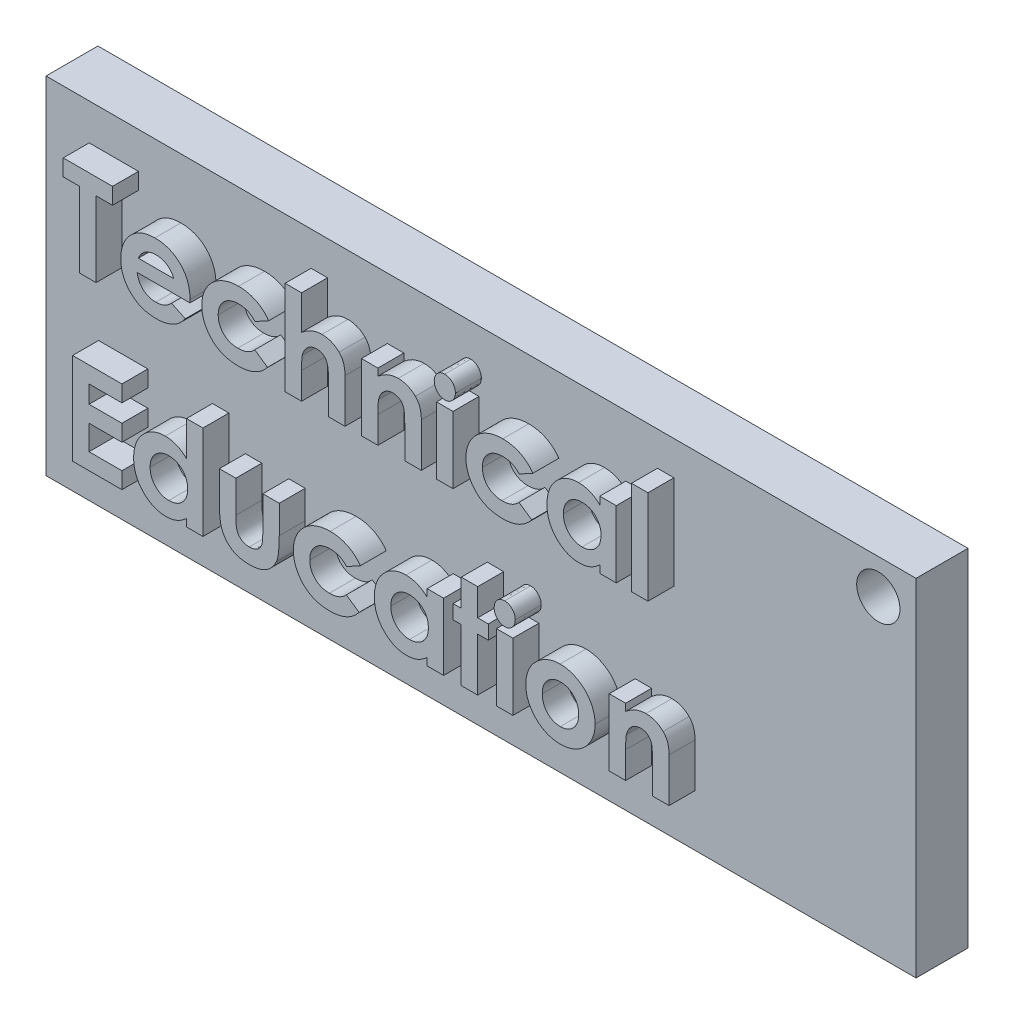
from build123d import *

# Parameters (mm, degrees)
BOSS_EXTRUDE1_DEPTH = 3
SKETCH3_W           = 0.949786325
SKETCH3_H           = 3.86698718
SKETCH3_W_2         = 0.949786324
SKETCH3_H_2         = 5.427350428
BOSS_EXTRUDE2_DEPTH = 1.5
SKETCH4_R           = 1.25
CUT_EXTRUDE1_DEPTH  = 41.5
SKETCH6_W           = 50.270674218
SKETCH6_H           = 20
BOSS_EXTRUDE3_DEPTH = 3
SKETCH7_R           = 1.25
CUT_EXTRUDE2_DEPTH  = 3


with BuildPart() as part:
    # Sketch1 → Boss-Extrude1 (new body)
    with BuildSketch(Plane.XY):
        with BuildLine():
            Line((-23, -10), (23, -10))
            ThreePointArc((23, -10), (24.414213562, -9.414213562), (25, -8))
            Line((25, -8), (25, 8))
            ThreePointArc((25, 8), (24.414213562, 9.414213562), (23, 10))
            Line((23, 10), (-23, 10))
            ThreePointArc((-23, 10), (-24.414213562, 9.414213562), (-25, 8))
            Line((-25, 8), (-25, -8))
            ThreePointArc((-25, -8), (-24.414213562, -9.414213562), (-23, -10))
        make_face()
    extrude(amount=BOSS_EXTRUDE1_DEPTH)

    # Sketch3 → Boss-Extrude2 (add)
    # profile 1 of 20: a face of its own
    with BuildSketch(Plane.XY.offset(3)):
        Polygon((-22.641889718, 7.899192591), (-19.792530744, 7.899192591), (-19.792530744, 6.949406266), (-20.742317068, 6.949406266), (-20.742317068, 2.607525924), (-21.692103393, 2.607525924), (-21.692103393, 6.949406266), (-22.641889718, 6.949406266), align=None)
    # profile 2 of 20: a face of its own
    with BuildSketch(Plane.XY.offset(3)):
        with BuildLine():
            Line((-15.318146729, 4.303572933), (-18.367851256, 4.303572933))
            add(Edge.make_bspline(
                [(-18.367851256, 4.303572933), (-18.361633155, 4.268137097), (-18.349414095, 4.198502882), (-18.322879973, 4.097353144), (-18.289018454, 4.002031337), (-18.248437555, 3.912410041), (-18.201821471, 3.828015463), (-18.14744767, 3.749243445), (-18.086005836, 3.676163566), (-18.017851208, 3.609093438), (-17.944119801, 3.548997149), (-17.865169184, 3.496349002), (-17.780917885, 3.453180741), (-17.692331814, 3.416794377), (-17.598749029, 3.38797269), (-17.5000318, 3.368094921), (-17.396441811, 3.35635305), (-17.325873145, 3.354654723), (-17.289801377, 3.353786608)],
                knots=[0, 0, 0, 0, 1.091296461, 2.144483647, 3.168565212, 4.157007626, 5.126487748, 6.090021542, 7.05641414, 8.019231907, 8.98705074, 9.938580405, 10.892824166, 11.854447369, 12.841318655, 13.858982407, 14.905600794, 16, 16, 16, 16], degree=3))
            add(Edge.make_bspline(
                [(-17.289801377, 3.353786608), (-17.246260303, 3.354936135), (-17.160515107, 3.357199891), (-17.034897756, 3.377276044), (-16.913407479, 3.407600192), (-16.797194002, 3.452694745), (-16.684911176, 3.508829536), (-16.578407518, 3.578766579), (-16.475839536, 3.660462084), (-16.41326098, 3.723432948), (-16.381356198, 3.755537743)],
                knots=[0, 0, 0, 0, 1.021034703, 2.010718019, 2.977989445, 3.954245119, 4.929443971, 5.918328161, 6.938689359, 8, 8, 8, 8], degree=3))
            Line((-16.381356198, 3.755537743), (-15.586334162, 3.377107255))
            add(Edge.make_bspline(
                [(-15.586334162, 3.377107255), (-15.611364967, 3.342518524), (-15.660962586, 3.273982226), (-15.741929035, 3.177533955), (-15.82642268, 3.087543805), (-15.914506536, 3.004603655), (-16.006292317, 2.928949853), (-16.101524695, 2.859660797), (-16.201595453, 2.798596872), (-16.304503694, 2.742803841), (-16.412376723, 2.694972735), (-16.524916007, 2.654184055), (-16.641644878, 2.617311436), (-16.764037371, 2.589216521), (-16.891074324, 2.566976815), (-17.023059634, 2.551183677), (-17.159975907, 2.541429013), (-17.2530371, 2.540272609), (-17.30040167, 2.539684044)],
                knots=[0, 0, 0, 0, 1.028154879, 2.037251081, 3.030720504, 4.000128189, 4.949298328, 5.894184978, 6.834267904, 7.770992897, 8.712077017, 9.673380525, 10.653304757, 11.658697181, 12.695551717, 13.758623199, 14.859225354, 16, 16, 16, 16], degree=3))
            add(Edge.make_bspline(
                [(-17.30040167, 2.539684044), (-17.373271284, 2.541169636), (-17.515982223, 2.544079083), (-17.724722769, 2.571082912), (-17.922968392, 2.615858172), (-18.111278868, 2.67672326), (-18.288840193, 2.757084245), (-18.455740243, 2.855372395), (-18.613646588, 2.969703331), (-18.757734308, 3.102476553), (-18.889002472, 3.246992313), (-19.004300266, 3.40219237), (-19.100779818, 3.566992401), (-19.180010766, 3.740301724), (-19.241591812, 3.922563943), (-19.285988173, 4.113858595), (-19.313203675, 4.314094313), (-19.316143084, 4.450477188), (-19.317637581, 4.519818927)],
                knots=[0, 0, 0, 0, 1.103565453, 2.161269334, 3.182010356, 4.179077853, 5.15417608, 6.128274628, 7.109042802, 8.101804412, 9.090965879, 10.063106201, 11.02526161, 11.978650795, 12.945248442, 13.93468508, 14.949922959, 16, 16, 16, 16], degree=3))
            add(Edge.make_bspline(
                [(-19.317637581, 4.519818927), (-19.316128375, 4.590922727), (-19.313159081, 4.730816262), (-19.286222499, 4.935675514), (-19.241469071, 5.131138949), (-19.179707887, 5.31747574), (-19.101678882, 5.49526867), (-19.003971794, 5.662962263), (-18.889059688, 5.821140336), (-18.758264415, 5.969062918), (-18.613566295, 6.102579209), (-18.459810871, 6.221568906), (-18.295270545, 6.32071902), (-18.121806408, 6.40083225), (-17.940528001, 6.465922228), (-17.749339997, 6.509234172), (-17.549697046, 6.53831555), (-17.413225522, 6.540993763), (-17.343862875, 6.542354984)],
                knots=[0, 0, 0, 0, 1.079208495, 2.12329425, 3.130605359, 4.119693003, 5.099659317, 6.073216462, 7.060498243, 8.06384408, 9.066070512, 10.045757761, 11.010926815, 11.975797609, 12.942977511, 13.929384301, 14.947594487, 16, 16, 16, 16], degree=3))
            add(Edge.make_bspline(
                [(-17.343862875, 6.542354984), (-17.270644166, 6.540846344), (-17.126886777, 6.537884285), (-16.916692417, 6.511099721), (-16.717130468, 6.466051427), (-16.527350683, 6.405712628), (-16.349776628, 6.32332164), (-16.180506463, 6.227452205), (-16.023600246, 6.11064992), (-15.877385524, 5.978526447), (-15.745396855, 5.831940032), (-15.630024134, 5.672702289), (-15.531856149, 5.502367286), (-15.452290022, 5.320244276), (-15.390772209, 5.126880012), (-15.34633475, 4.922525615), (-15.319326838, 4.706403818), (-15.316442124, 4.558412838), (-15.314966641, 4.482717898)],
                knots=[0, 0, 0, 0, 1.080001299, 2.120471247, 3.119684163, 4.095710327, 5.052285597, 6.002875087, 6.961153713, 7.931888285, 8.906493152, 9.865905668, 10.82813294, 11.801621613, 12.7925306, 13.817193356, 14.883530496, 16, 16, 16, 16], degree=3))
            Line((-15.314966641, 4.482717898), (-15.318146729, 4.303572933))
        make_face()
        with BuildLine():
            add(Edge.make_bspline(
                [(-16.264752966, 5.049833617), (-16.282676015, 5.098200665), (-16.318311705, 5.194366958), (-16.398811245, 5.327052976), (-16.50563156, 5.441964457), (-16.62987125, 5.543696502), (-16.771822875, 5.626268584), (-16.927013291, 5.686053454), (-17.09348092, 5.721901212), (-17.208001679, 5.726105524), (-17.26648073, 5.72825242)],
                knots=[0, 0, 0, 0, 0.954238005, 1.897273737, 2.851915805, 3.847685534, 4.862635127, 5.880135777, 6.917509367, 8, 8, 8, 8], degree=3))
            add(Edge.make_bspline(
                [(-17.26648073, 5.72825242), (-17.330349375, 5.726190065), (-17.455199278, 5.72215859), (-17.635286762, 5.679282372), (-17.80515878, 5.615290898), (-17.905305694, 5.54931433), (-17.955499827, 5.516246544)],
                knots=[0, 0, 0, 0, 1.044195649, 2.041185066, 3.018232172, 4, 4, 4, 4], degree=3))
            add(Edge.make_bspline(
                [(-17.955499827, 5.516246544), (-17.986817218, 5.491061394), (-18.053584293, 5.437367942), (-18.140294886, 5.330254603), (-18.225705542, 5.200564395), (-18.274266209, 5.102055519), (-18.300009376, 5.049833617)],
                knots=[0, 0, 0, 0, 0.82159062, 1.751589201, 2.808063854, 4, 4, 4, 4], degree=3))
            Line((-18.300009376, 5.049833617), (-16.264752966, 5.049833617))
        make_face(mode=Mode.SUBTRACT)
    # profile 3 of 20: a face of its own
    with BuildSketch(Plane.XY.offset(3)):
        with BuildLine():
            Line((-10.769560658, 5.685851245), (-11.556102458, 5.253359258))
            add(Edge.make_bspline(
                [(-11.556102458, 5.253359258), (-11.592154668, 5.289462369), (-11.661456078, 5.358861626), (-11.772586459, 5.446710075), (-11.881731087, 5.519446146), (-11.993389541, 5.573121631), (-12.108559917, 5.613544416), (-12.23139627, 5.640317314), (-12.363332316, 5.657946317), (-12.454592629, 5.659572197), (-12.501648666, 5.66041054)],
                knots=[0, 0, 0, 0, 1.150764855, 2.212059359, 3.192108068, 4.105322427, 5.000809612, 5.941206042, 6.938435785, 8, 8, 8, 8], degree=3))
            add(Edge.make_bspline(
                [(-12.501648666, 5.66041054), (-12.544802298, 5.65936822), (-12.629250339, 5.657328489), (-12.752642327, 5.64209309), (-12.869913767, 5.61816409), (-12.980854151, 5.583155878), (-13.085265882, 5.536908124), (-13.184012402, 5.482180865), (-13.276134152, 5.416836526), (-13.360328968, 5.341803962), (-13.436329588, 5.259194771), (-13.504126019, 5.171088519), (-13.559667306, 5.076178171), (-13.607686193, 4.976694463), (-13.642990265, 4.870768869), (-13.668819582, 4.759362553), (-13.683542053, 4.642470581), (-13.685675079, 4.562613394), (-13.686761513, 4.521938985)],
                knots=[0, 0, 0, 0, 1.121765476, 2.195200973, 3.227634963, 4.230038321, 5.213228299, 6.192116585, 7.160777141, 8.14345191, 9.118668839, 10.075979138, 11.027630062, 11.972829041, 12.943187208, 13.923755399, 14.94248691, 16, 16, 16, 16], degree=3))
            add(Edge.make_bspline(
                [(-13.686761513, 4.521938985), (-13.685613602, 4.482326045), (-13.683372224, 4.404978973), (-13.669601953, 4.291337692), (-13.645696245, 4.183156042), (-13.609852766, 4.081005947), (-13.566890348, 3.983945729), (-13.512937416, 3.892747327), (-13.449491741, 3.8070125), (-13.376219307, 3.727486409), (-13.295052043, 3.655962448), (-13.207547369, 3.592799385), (-13.113966361, 3.539248793), (-13.013218896, 3.497223613), (-12.906947558, 3.462981884), (-12.794442665, 3.438600432), (-12.675823938, 3.42506704), (-12.594964556, 3.42279239), (-12.553590105, 3.421628489)],
                knots=[0, 0, 0, 0, 1.070556293, 2.090336998, 3.088792742, 4.058148387, 5.011235098, 5.952916408, 6.915475435, 7.888633318, 8.869583867, 9.83422472, 10.800707077, 11.776204622, 12.778807041, 13.814557445, 14.881744048, 16, 16, 16, 16], degree=3))
            add(Edge.make_bspline(
                [(-12.553590105, 3.421628489), (-12.50264824, 3.422794187), (-12.403217121, 3.425069462), (-12.25867313, 3.444367611), (-12.122659212, 3.476279964), (-11.995160943, 3.520449194), (-11.876356697, 3.578201286), (-11.766551731, 3.648741158), (-11.664617253, 3.731548447), (-11.605174682, 3.796106875), (-11.575182987, 3.828679771)],
                knots=[0, 0, 0, 0, 1.116373375, 2.178998604, 3.189797796, 4.174590301, 5.13072713, 6.078291395, 7.030403691, 8, 8, 8, 8], degree=3))
            Line((-11.575182987, 3.828679771), (-10.837402538, 3.321985727))
            add(Edge.make_bspline(
                [(-10.837402538, 3.321985727), (-10.888541936, 3.259461347), (-10.989461647, 3.136074238), (-11.165538558, 2.977032759), (-11.355050497, 2.84038079), (-11.561808959, 2.731306919), (-11.782802856, 2.644552599), (-12.019759044, 2.583225908), (-12.272276728, 2.547125498), (-12.445701431, 2.542204177), (-12.534509576, 2.539684044)],
                knots=[0, 0, 0, 0, 0.997876357, 1.969233105, 2.924898516, 3.881013542, 4.852507933, 5.855329832, 6.901747111, 8, 8, 8, 8], degree=3))
            add(Edge.make_bspline(
                [(-12.534509576, 2.539684044), (-12.614442415, 2.541531854), (-12.770560063, 2.545140831), (-12.998097656, 2.572778784), (-13.212108577, 2.619331154), (-13.41303308, 2.683982827), (-13.60068798, 2.767730953), (-13.774464696, 2.871609922), (-13.935535347, 2.992730198), (-14.080993574, 3.131663949), (-14.210775687, 3.282894838), (-14.32407594, 3.442165008), (-14.422063182, 3.606620803), (-14.498934077, 3.778999526), (-14.561758785, 3.956614361), (-14.60418862, 4.141588442), (-14.63217371, 4.332398112), (-14.63507806, 4.461769385), (-14.636547838, 4.527239132)],
                knots=[0, 0, 0, 0, 1.183377041, 2.311265848, 3.387807024, 4.421911742, 5.431260577, 6.423665966, 7.413571885, 8.409103097, 9.395976332, 10.359992013, 11.300391101, 12.225292883, 13.150239058, 14.085544813, 15.031169026, 16, 16, 16, 16], degree=3))
            add(Edge.make_bspline(
                [(-14.636547838, 4.527239132), (-14.635760467, 4.57285246), (-14.634200928, 4.663198438), (-14.620887394, 4.797372291), (-14.600176011, 4.929269266), (-14.569049246, 5.057963518), (-14.530768819, 5.184079422), (-14.484233778, 5.307591629), (-14.427608608, 5.427862795), (-14.364443058, 5.545916017), (-14.292451923, 5.658634865), (-14.213911088, 5.765969591), (-14.12893121, 5.867262818), (-14.036513991, 5.961570522), (-13.937303821, 6.049567512), (-13.832742961, 6.133039084), (-13.71944787, 6.207680417), (-13.601357124, 6.277857056), (-13.477453492, 6.340327782), (-13.349161079, 6.394248254), (-13.217471298, 6.440061472), (-13.082068494, 6.476896223), (-12.943533844, 6.507254811), (-12.800634635, 6.526521619), (-12.654553117, 6.540063845), (-12.555742323, 6.541586667), (-12.505888783, 6.542354984)],
                knots=[0, 0, 0, 0, 1.00272354, 1.986087015, 2.96193297, 3.936200312, 4.894695956, 5.858592327, 6.835334787, 7.815655071, 8.800643866, 9.773423113, 10.738352213, 11.705312252, 12.673769326, 13.65298065, 14.64420052, 15.654211674, 16.672258995, 17.692438602, 18.712115155, 19.735602823, 20.776372304, 21.827874031, 22.90408564, 24, 24, 24, 24], degree=3))
            add(Edge.make_bspline(
                [(-12.505888783, 6.542354984), (-12.459581241, 6.541831438), (-12.368252975, 6.540798894), (-12.233381772, 6.530002215), (-12.102189581, 6.511663579), (-11.974453137, 6.487402337), (-11.849784508, 6.457338433), (-11.729854582, 6.417264257), (-11.613023717, 6.371781575), (-11.462544328, 6.303107475), (-11.28515667, 6.200600265), (-11.090432547, 6.05358233), (-10.916812418, 5.881592787), (-10.818905465, 5.751445222), (-10.769560658, 5.685851245)],
                knots=[0, 0, 0, 0, 0.826738014, 1.630502179, 2.413926014, 3.191023582, 3.95155221, 4.701751672, 5.446919844, 6.189438973, 7.653650558, 9.094719814, 10.535747635, 12, 12, 12, 12], degree=3))
        make_face()
    # profile 4 of 20: a face of its own
    with BuildSketch(Plane.XY.offset(3)):
        with BuildLine():
            Line((-9.819774333, 8.034876352), (-8.869988008, 8.034876352))
            Line((-8.869988008, 8.034876352), (-8.869988008, 6.055801499))
            add(Edge.make_bspline(
                [(-8.869988008, 6.055801499), (-8.822145258, 6.094710049), (-8.728891448, 6.170549556), (-8.582573162, 6.269350439), (-8.436557517, 6.353661579), (-8.289295073, 6.421989993), (-8.141424707, 6.47553497), (-7.992691071, 6.513508174), (-7.842950982, 6.538421948), (-7.742567464, 6.541042574), (-7.692295367, 6.542354984)],
                knots=[0, 0, 0, 0, 1.13710654, 2.216417683, 3.252896077, 4.244436563, 5.207303112, 6.149540546, 7.073289332, 8, 8, 8, 8], degree=3))
            add(Edge.make_bspline(
                [(-7.692295367, 6.542354984), (-7.644188344, 6.541078504), (-7.549750219, 6.538572666), (-7.411203764, 6.520472645), (-7.278503928, 6.489327174), (-7.151323811, 6.446512325), (-7.030538389, 6.388932661), (-6.91457698, 6.321485354), (-6.804817942, 6.240677172), (-6.738035819, 6.178386284), (-6.704347984, 6.146964025)],
                knots=[0, 0, 0, 0, 1.056403236, 2.073808271, 3.062028718, 4.046096703, 5.014652014, 5.995532726, 6.988858718, 8, 8, 8, 8], degree=3))
            add(Edge.make_bspline(
                [(-6.704347984, 6.146964025), (-6.67668138, 6.117602803), (-6.620946755, 6.058454355), (-6.551530767, 5.956483798), (-6.491590756, 5.845412558), (-6.442748191, 5.724196906), (-6.406423225, 5.592780418), (-6.378300335, 5.452245722), (-6.362747779, 5.30105834), (-6.360828379, 5.196858118), (-6.359838436, 5.143116202)],
                knots=[0, 0, 0, 0, 0.887296576, 1.787466942, 2.706642908, 3.663267187, 4.658426068, 5.705361056, 6.816525637, 8, 8, 8, 8], degree=3))
            Line((-6.359838436, 5.143116202), (-6.359838436, 2.607525924))
            Line((-6.359838436, 2.607525924), (-7.309624761, 2.607525924))
            Line((-7.309624761, 2.607525924), (-7.309624761, 4.288732522))
            add(Edge.make_bspline(
                [(-7.309624761, 4.288732522), (-7.309809306, 4.342088944), (-7.310162545, 4.44421864), (-7.31333464, 4.590879564), (-7.31851477, 4.724115408), (-7.325598834, 4.843966434), (-7.335489735, 4.949931765), (-7.345218132, 5.042770922), (-7.358869352, 5.122038891), (-7.379310324, 5.208171073), (-7.412576197, 5.300296393), (-7.460916927, 5.398498023), (-7.525486858, 5.479544551), (-7.600210586, 5.546387618), (-7.686608683, 5.597404775), (-7.78158818, 5.635085161), (-7.886772805, 5.656275678), (-7.959682053, 5.658996253), (-7.997583828, 5.66041054)],
                knots=[0, 0, 0, 0, 1.461461505, 2.797388094, 4.017818807, 5.113567707, 6.085313608, 6.932873269, 7.669572396, 8.286941306, 9.355291607, 10.346554054, 11.270113241, 12.175128673, 13.078071705, 14.003657132, 14.962203834, 16, 16, 16, 16], degree=3))
            add(Edge.make_bspline(
                [(-7.997583828, 5.66041054), (-8.046958613, 5.658480317), (-8.143664694, 5.654699758), (-8.282345493, 5.615783422), (-8.410260285, 5.554271213), (-8.525916186, 5.469018059), (-8.626698031, 5.362235089), (-8.711137663, 5.237074783), (-8.78020466, 5.094789017), (-8.810056659, 4.991031777), (-8.825466775, 4.937470502)],
                knots=[0, 0, 0, 0, 0.993549393, 1.945978497, 2.879753144, 3.843180486, 4.826017097, 5.826060929, 6.877775219, 8, 8, 8, 8], degree=3))
            add(Edge.make_bspline(
                [(-8.825466775, 4.937470502), (-8.829303926, 4.920915492), (-8.838053888, 4.88316465), (-8.844754774, 4.81875523), (-8.854698783, 4.740895279), (-8.8581482, 4.649118217), (-8.864609776, 4.543565601), (-8.866933612, 4.424066654), (-8.869273125, 4.29050903), (-8.869742054, 4.196865145), (-8.869988008, 4.147748614)],
                knots=[0, 0, 0, 0, 0.514379255, 1.17295301, 1.959069106, 2.891908278, 3.953016936, 5.163065833, 6.51201855, 8, 8, 8, 8], degree=3))
            Line((-8.869988008, 4.147748614), (-8.869988008, 2.607525924))
            Line((-8.869988008, 2.607525924), (-9.819774333, 2.607525924))
            Line((-9.819774333, 2.607525924), (-9.819774333, 8.034876352))
        make_face()
    # profile 5 of 20: a face of its own
    with BuildSketch(Plane.XY.offset(3)):
        with BuildLine():
            Line((-5.410052111, 6.474513104), (-4.460265786, 6.474513104))
            Line((-4.460265786, 6.474513104), (-4.460265786, 6.065341763))
            add(Edge.make_bspline(
                [(-4.460265786, 6.065341763), (-4.406080947, 6.107487847), (-4.302523187, 6.188037206), (-4.14509751, 6.290738049), (-3.996507163, 6.374794565), (-3.853439906, 6.438732253), (-3.713203926, 6.48473267), (-3.573528, 6.517781225), (-3.432332071, 6.538943124), (-3.337414133, 6.541218308), (-3.28999335, 6.542354984)],
                knots=[0, 0, 0, 0, 1.276643801, 2.439914479, 3.493451431, 4.44993799, 5.350072675, 6.235028322, 7.118224225, 8, 8, 8, 8], degree=3))
            add(Edge.make_bspline(
                [(-3.28999335, 6.542354984), (-3.241891348, 6.541055998), (-3.147463077, 6.53850598), (-3.008422652, 6.520670666), (-2.875583028, 6.48818691), (-2.747450534, 6.445057267), (-2.62532934, 6.388128613), (-2.507723386, 6.320535072), (-2.397158806, 6.238201566), (-2.329068243, 6.175500321), (-2.294625762, 6.143783937)],
                knots=[0, 0, 0, 0, 1.048836932, 2.058954983, 3.049370783, 4.026390553, 5.001981509, 5.982488534, 6.97947532, 8, 8, 8, 8], degree=3))
            add(Edge.make_bspline(
                [(-2.294625762, 6.143783937), (-2.267001625, 6.114392124), (-2.211551174, 6.055393384), (-2.141773749, 5.95443143), (-2.081896869, 5.844364419), (-2.032836086, 5.723922695), (-1.996582144, 5.592444507), (-1.968691492, 5.451517923), (-1.95304156, 5.30035386), (-1.951109502, 5.196505576), (-1.950116214, 5.143116202)],
                knots=[0, 0, 0, 0, 0.889584746, 1.785680191, 2.700364693, 3.65222533, 4.649950538, 5.707241244, 6.821271309, 8, 8, 8, 8], degree=3))
            Line((-1.950116214, 5.143116202), (-1.950116214, 2.607525924))
            Line((-1.950116214, 2.607525924), (-2.899902538, 2.607525924))
            Line((-2.899902538, 2.607525924), (-2.899902538, 4.286612463))
            add(Edge.make_bspline(
                [(-2.899902538, 4.286612463), (-2.900103397, 4.341381341), (-2.900488306, 4.44633573), (-2.903443553, 4.596541233), (-2.909213916, 4.732196309), (-2.914473453, 4.853547945), (-2.924800013, 4.960165263), (-2.934112672, 5.052723231), (-2.948402044, 5.130382157), (-2.966994836, 5.213915984), (-2.999462429, 5.303354221), (-3.049866784, 5.397592179), (-3.113811778, 5.477649426), (-3.188685639, 5.544087202), (-3.274405678, 5.596645576), (-3.369936092, 5.633623667), (-3.474764723, 5.656669321), (-3.547808081, 5.659131738), (-3.585741547, 5.66041054)],
                knots=[0, 0, 0, 0, 1.49886392, 2.872294502, 4.110984203, 5.214877267, 6.195405875, 7.042225351, 7.75923308, 8.355011229, 9.382752534, 10.352059385, 11.267231453, 12.171456522, 13.078624015, 14.003401117, 14.963110155, 16, 16, 16, 16], degree=3))
            add(Edge.make_bspline(
                [(-3.585741547, 5.66041054), (-3.635075616, 5.657908796), (-3.731582645, 5.653014899), (-3.871160755, 5.616110449), (-3.999360924, 5.553346843), (-4.11513565, 5.466494632), (-4.217382277, 5.359264816), (-4.301595311, 5.23138096), (-4.370667299, 5.085929532), (-4.400369281, 4.979726364), (-4.415744552, 4.92475015)],
                knots=[0, 0, 0, 0, 0.984188326, 1.925263693, 2.85911992, 3.81709677, 4.80007086, 5.801799564, 6.862098548, 8, 8, 8, 8], degree=3))
            add(Edge.make_bspline(
                [(-4.415744552, 4.92475015), (-4.419565918, 4.907484501), (-4.428088332, 4.868978634), (-4.435096939, 4.803927179), (-4.444846421, 4.726749927), (-4.448499312, 4.636050185), (-4.454851288, 4.532257199), (-4.457200552, 4.415233652), (-4.459554019, 4.285209008), (-4.460020671, 4.194391735), (-4.460265786, 4.146688585)],
                knots=[0, 0, 0, 0, 0.543362196, 1.211806945, 2.009705693, 2.934833164, 4.000995085, 5.207458376, 6.533175157, 8, 8, 8, 8], degree=3))
            Line((-4.460265786, 4.146688585), (-4.460265786, 2.607525924))
            Line((-4.460265786, 2.607525924), (-5.410052111, 2.607525924))
            Line((-5.410052111, 2.607525924), (-5.410052111, 6.474513104))
        make_face()
    # profile 6 of 20: a face of its own
    with BuildSketch(Plane.XY.offset(3)):
        with BuildLine():
            add(Edge.make_bspline(
                [(-0.595398666, 8.102718232), (-0.554462882, 8.100709768), (-0.474081526, 8.096765954), (-0.358924296, 8.058322545), (-0.253233296, 7.997986763), (-0.159799522, 7.915204633), (-0.082090046, 7.816347628), (-0.02271712, 7.705670638), (0.010357064, 7.583044097), (0.014950579, 7.498334966), (0.017298316, 7.455040281)],
                knots=[0, 0, 0, 0, 0.989868614, 1.943702388, 2.910836514, 3.924849579, 4.949916355, 5.946401046, 6.950409252, 8, 8, 8, 8], degree=3))
            add(Edge.make_bspline(
                [(0.017298316, 7.455040281), (0.015034577, 7.412064653), (0.010623574, 7.328324597), (-0.023478342, 7.207362769), (-0.080468245, 7.096739535), (-0.15880712, 6.99935074), (-0.25122795, 6.917901865), (-0.35460952, 6.856470723), (-0.46866321, 6.820165912), (-0.54779729, 6.815892418), (-0.58797846, 6.813722506)],
                knots=[0, 0, 0, 0, 1.05296456, 2.051751585, 3.055639087, 4.085634717, 5.099016424, 6.062201612, 7.016062274, 8, 8, 8, 8], degree=3))
            add(Edge.make_bspline(
                [(-0.58797846, 6.813722506), (-0.629271579, 6.81572379), (-0.71035225, 6.819653392), (-0.826454006, 6.858186749), (-0.933554653, 6.918047348), (-1.026583112, 7.002520846), (-1.105182536, 7.102080305), (-1.161962029, 7.215333951), (-1.197479007, 7.338799008), (-1.201694841, 7.424762739), (-1.20385553, 7.468820663)],
                knots=[0, 0, 0, 0, 0.989065327, 1.942068821, 2.907541208, 3.917690034, 4.939857478, 5.938239964, 6.943311734, 8, 8, 8, 8], degree=3))
            add(Edge.make_bspline(
                [(-1.20385553, 7.468820663), (-1.201504109, 7.511066538), (-1.196885084, 7.594052462), (-1.163612782, 7.713952655), (-1.105601275, 7.822768992), (-1.028451547, 7.919816327), (-0.935838436, 8.001054259), (-0.830210885, 8.059557604), (-0.715828667, 8.096413191), (-0.635956498, 8.100594851), (-0.595398666, 8.102718232)],
                knots=[0, 0, 0, 0, 1.038616768, 2.040212704, 3.031499824, 4.052181184, 5.074969369, 6.039807101, 7.004644834, 8, 8, 8, 8], degree=3))
        make_face()
    # profile 7 of 20: a face of its own
    with BuildSketch(Plane.XY.offset(3)):
        with Locations((-0.593278607, 4.541019514)):
            Rectangle(SKETCH3_W, SKETCH3_H)
    # profile 8 of 20: a face of its own
    with BuildSketch(Plane.XY.offset(3)):
        with BuildLine():
            Line((4.494862419, 5.685851245), (3.708320619, 5.253359258))
            add(Edge.make_bspline(
                [(3.708320619, 5.253359258), (3.672268409, 5.289462369), (3.602966999, 5.358861626), (3.491836618, 5.446710075), (3.38269199, 5.519446146), (3.271033536, 5.573121631), (3.15586316, 5.613544416), (3.033026807, 5.640317314), (2.901090761, 5.657946317), (2.809830448, 5.659572197), (2.762774411, 5.66041054)],
                knots=[0, 0, 0, 0, 1.150764855, 2.212059359, 3.192108068, 4.105322427, 5.000809612, 5.941206042, 6.938435785, 8, 8, 8, 8], degree=3))
            add(Edge.make_bspline(
                [(2.762774411, 5.66041054), (2.719620779, 5.65936822), (2.635172738, 5.657328489), (2.51178075, 5.64209309), (2.39450931, 5.61816409), (2.283568926, 5.583155878), (2.179157195, 5.536908124), (2.080410675, 5.482180865), (1.988288924, 5.416836526), (1.904094108, 5.341803962), (1.828093489, 5.259194771), (1.760297058, 5.171088519), (1.704755771, 5.076178171), (1.656736884, 4.976694463), (1.621432812, 4.870768869), (1.595603495, 4.759362553), (1.580881024, 4.642470581), (1.578747998, 4.562613394), (1.577661564, 4.521938985)],
                knots=[0, 0, 0, 0, 1.121765476, 2.195200973, 3.227634963, 4.230038321, 5.213228299, 6.192116585, 7.160777141, 8.14345191, 9.118668839, 10.075979138, 11.027630062, 11.972829041, 12.943187208, 13.923755399, 14.94248691, 16, 16, 16, 16], degree=3))
            add(Edge.make_bspline(
                [(1.577661564, 4.521938985), (1.578809475, 4.482326045), (1.581050853, 4.404978973), (1.594821124, 4.291337692), (1.618726832, 4.183156042), (1.654570311, 4.081005947), (1.697532729, 3.983945729), (1.751485661, 3.892747327), (1.814931336, 3.8070125), (1.88820377, 3.727486409), (1.969371034, 3.655962448), (2.056875708, 3.592799385), (2.150456716, 3.539248793), (2.251204181, 3.497223613), (2.357475519, 3.462981884), (2.469980412, 3.438600432), (2.588599138, 3.42506704), (2.669458521, 3.42279239), (2.710832972, 3.421628489)],
                knots=[0, 0, 0, 0, 1.070556293, 2.090336998, 3.088792742, 4.058148387, 5.011235098, 5.952916408, 6.915475435, 7.888633318, 8.869583867, 9.83422472, 10.800707077, 11.776204622, 12.778807041, 13.814557445, 14.881744048, 16, 16, 16, 16], degree=3))
            add(Edge.make_bspline(
                [(2.710832972, 3.421628489), (2.761774837, 3.422794187), (2.861205956, 3.425069462), (3.005749947, 3.444367611), (3.141763865, 3.476279964), (3.269262134, 3.520449194), (3.38806638, 3.578201286), (3.497871346, 3.648741158), (3.599805824, 3.731548447), (3.659248395, 3.796106875), (3.68924009, 3.828679771)],
                knots=[0, 0, 0, 0, 1.116373375, 2.178998604, 3.189797796, 4.174590301, 5.13072713, 6.078291395, 7.030403691, 8, 8, 8, 8], degree=3))
            Line((3.68924009, 3.828679771), (4.427020539, 3.321985727))
            add(Edge.make_bspline(
                [(4.427020539, 3.321985727), (4.375881141, 3.259461347), (4.27496143, 3.136074238), (4.098884519, 2.977032759), (3.90937258, 2.84038079), (3.702614118, 2.731306919), (3.481620221, 2.644552599), (3.244664033, 2.583225908), (2.992146349, 2.547125498), (2.818721646, 2.542204177), (2.729913501, 2.539684044)],
                knots=[0, 0, 0, 0, 0.997876357, 1.969233105, 2.924898516, 3.881013542, 4.852507933, 5.855329832, 6.901747111, 8, 8, 8, 8], degree=3))
            add(Edge.make_bspline(
                [(2.729913501, 2.539684044), (2.649980662, 2.541531854), (2.493863014, 2.545140831), (2.266325421, 2.572778784), (2.0523145, 2.619331154), (1.851389997, 2.683982827), (1.663735096, 2.767730953), (1.489958381, 2.871609922), (1.32888773, 2.992730198), (1.183429503, 3.131663949), (1.053647389, 3.282894838), (0.940347137, 3.442165008), (0.842359895, 3.606620803), (0.765489, 3.778999526), (0.702664292, 3.956614361), (0.660234457, 4.141588442), (0.632249367, 4.332398112), (0.629345017, 4.461769385), (0.627875239, 4.527239132)],
                knots=[0, 0, 0, 0, 1.183377041, 2.311265848, 3.387807024, 4.421911742, 5.431260577, 6.423665966, 7.413571885, 8.409103097, 9.395976332, 10.359992013, 11.300391101, 12.225292883, 13.150239058, 14.085544813, 15.031169026, 16, 16, 16, 16], degree=3))
            add(Edge.make_bspline(
                [(0.627875239, 4.527239132), (0.62866261, 4.57285246), (0.630222149, 4.663198438), (0.643535682, 4.797372291), (0.664247066, 4.929269266), (0.695373831, 5.057963518), (0.733654258, 5.184079422), (0.780189299, 5.307591629), (0.836814469, 5.427862795), (0.899980019, 5.545916017), (0.971971154, 5.658634865), (1.050511989, 5.765969591), (1.135491867, 5.867262818), (1.227909086, 5.961570522), (1.327119256, 6.049567512), (1.431680116, 6.133039084), (1.544975207, 6.207680417), (1.663065953, 6.277857056), (1.786969585, 6.340327782), (1.915261998, 6.394248254), (2.046951779, 6.440061472), (2.182354583, 6.476896223), (2.320889232, 6.507254811), (2.463788442, 6.526521619), (2.60986996, 6.540063845), (2.708680754, 6.541586667), (2.758534294, 6.542354984)],
                knots=[0, 0, 0, 0, 1.00272354, 1.986087015, 2.96193297, 3.936200312, 4.894695956, 5.858592327, 6.835334787, 7.815655071, 8.800643866, 9.773423113, 10.738352213, 11.705312252, 12.673769326, 13.65298065, 14.64420052, 15.654211674, 16.672258995, 17.692438602, 18.712115155, 19.735602823, 20.776372304, 21.827874031, 22.90408564, 24, 24, 24, 24], degree=3))
            add(Edge.make_bspline(
                [(2.758534294, 6.542354984), (2.804841836, 6.541831438), (2.896170102, 6.540798894), (3.031041305, 6.530002215), (3.162233496, 6.511663579), (3.28996994, 6.487402337), (3.414638569, 6.457338433), (3.534568495, 6.417264257), (3.65139936, 6.371781575), (3.801878749, 6.303107475), (3.979266407, 6.200600265), (4.17399053, 6.05358233), (4.347610659, 5.881592787), (4.445517612, 5.751445222), (4.494862419, 5.685851245)],
                knots=[0, 0, 0, 0, 0.826738014, 1.630502179, 2.413926014, 3.191023582, 3.95155221, 4.701751672, 5.446919844, 6.189438973, 7.653650558, 9.094719814, 10.535747635, 12, 12, 12, 12], degree=3))
        make_face()
    # profile 9 of 20: a face of its own
    with BuildSketch(Plane.XY.offset(3)):
        with BuildLine():
            Line((8.361849598, 6.474513104), (9.311635923, 6.474513104))
            Line((9.311635923, 6.474513104), (9.311635923, 2.607525924))
            Line((9.311635923, 2.607525924), (8.361849598, 2.607525924))
            Line((8.361849598, 2.607525924), (8.361849598, 3.029417618))
            add(Edge.make_bspline(
                [(8.361849598, 3.029417618), (8.314788036, 2.988351131), (8.223450837, 2.908649189), (8.079532966, 2.805233894), (7.935194551, 2.719929641), (7.789742041, 2.651989455), (7.640939892, 2.601822621), (7.487716789, 2.565500661), (7.327866155, 2.544080713), (7.219201897, 2.541164866), (7.164016399, 2.539684044)],
                knots=[0, 0, 0, 0, 1.129196829, 2.191548051, 3.199897424, 4.157751732, 5.089409408, 6.034969131, 7.002052659, 8, 8, 8, 8], degree=3))
            add(Edge.make_bspline(
                [(7.164016399, 2.539684044), (7.102068223, 2.541077684), (6.979655119, 2.543831596), (6.800027477, 2.572820963), (6.626579131, 2.617195651), (6.459450873, 2.67999138), (6.298946777, 2.761362334), (6.1438385, 2.859185432), (5.99678507, 2.976894849), (5.856562318, 3.109397598), (5.728175208, 3.255151565), (5.615937984, 3.412133704), (5.521330346, 3.578117571), (5.443823371, 3.752552852), (5.382854125, 3.935311523), (5.339391778, 4.126973237), (5.313748943, 4.327606448), (5.310575082, 4.464269933), (5.308964983, 4.533599309)],
                knots=[0, 0, 0, 0, 0.980476535, 1.937477201, 2.874147792, 3.812856188, 4.758993464, 5.720109578, 6.712210464, 7.737600662, 8.772720504, 9.783789959, 10.789002326, 11.793715968, 12.802552247, 13.835794126, 14.902098527, 16, 16, 16, 16], degree=3))
            add(Edge.make_bspline(
                [(5.308964983, 4.533599309), (5.310654788, 4.605389968), (5.313969529, 4.746215346), (5.338216661, 4.952869893), (5.380876965, 5.149283843), (5.439047355, 5.33572926), (5.513873462, 5.512238354), (5.605006661, 5.679100303), (5.713686733, 5.835878957), (5.838921249, 5.979905832), (5.974143768, 6.11191342), (6.118807958, 6.226836494), (6.270651588, 6.324468993), (6.429836017, 6.404175), (6.596338514, 6.465767768), (6.76950173, 6.510797111), (6.950094386, 6.537816299), (7.073115568, 6.540829525), (7.135395605, 6.542354984)],
                knots=[0, 0, 0, 0, 1.136281865, 2.228943489, 3.287578264, 4.313574083, 5.316051562, 6.317280042, 7.318008486, 8.329309503, 9.333984563, 10.305318864, 11.248632312, 12.186624717, 13.117503092, 14.05354244, 15.014596925, 16, 16, 16, 16], degree=3))
            add(Edge.make_bspline(
                [(7.135395605, 6.542354984), (7.1930871, 6.541156431), (7.307237774, 6.538784927), (7.475022817, 6.513034931), (7.637750109, 6.47408989), (7.794531965, 6.418600217), (7.946654361, 6.348533215), (8.091500696, 6.26073404), (8.232239616, 6.158892851), (8.318112485, 6.079352724), (8.361849598, 6.038841029)],
                knots=[0, 0, 0, 0, 1.017011718, 2.012299608, 2.98747302, 3.965332399, 4.941441765, 5.936729654, 6.94912688, 8, 8, 8, 8], degree=3))
            Line((8.361849598, 6.038841029), (8.361849598, 6.474513104))
        make_face()
        with BuildLine():
            add(Edge.make_bspline(
                [(7.334681129, 5.66041054), (7.296834944, 5.659249288), (7.222658892, 5.656973311), (7.113572856, 5.643283149), (7.009319331, 5.619160473), (6.910641843, 5.583524399), (6.816069737, 5.540114469), (6.727039103, 5.485744246), (6.642815146, 5.421479798), (6.563893195, 5.348876966), (6.491944208, 5.26907318), (6.429919982, 5.181989958), (6.377209411, 5.089973699), (6.332629967, 4.992747741), (6.300721199, 4.889161602), (6.275449468, 4.780563788), (6.262335076, 4.666067111), (6.25995785, 4.588041169), (6.258751308, 4.54843972)],
                knots=[0, 0, 0, 0, 1.04836806, 2.054732945, 3.03993516, 4.00574415, 4.955904794, 5.917688631, 6.888591924, 7.88601754, 8.884115178, 9.859153345, 10.841239365, 11.818093293, 12.814750328, 13.83810466, 14.90274714, 16, 16, 16, 16], degree=3))
            add(Edge.make_bspline(
                [(6.258751308, 4.54843972), (6.25993942, 4.508479063), (6.26228058, 4.429737052), (6.275661515, 4.314274554), (6.300023865, 4.204090381), (6.335567614, 4.100075297), (6.378974777, 4.000825794), (6.431811056, 3.906799918), (6.496711171, 3.819660165), (6.568723228, 3.737344515), (6.649264251, 3.663839834), (6.733964781, 3.598574426), (6.823981762, 3.5439669), (6.918338572, 3.499832753), (7.016717603, 3.463867133), (7.120352229, 3.440047629), (7.228227219, 3.424820272), (7.301768448, 3.422699763), (7.338921246, 3.421628489)],
                knots=[0, 0, 0, 0, 1.099136573, 2.165835871, 3.191374663, 4.196217796, 5.183857741, 6.167377911, 7.154730987, 8.166690795, 9.170734848, 10.148332609, 11.103258353, 12.059567475, 13.009337315, 13.978056681, 14.978520572, 16, 16, 16, 16], degree=3))
            add(Edge.make_bspline(
                [(7.338921246, 3.421628489), (7.377472361, 3.42279625), (7.453053503, 3.425085698), (7.563919222, 3.438650923), (7.669573246, 3.462862047), (7.769575998, 3.498702146), (7.865454925, 3.541800478), (7.956344805, 3.595108265), (8.041259347, 3.659225244), (8.120628603, 3.732484408), (8.193355226, 3.81293984), (8.256237198, 3.90116502), (8.311009696, 3.994338264), (8.354085745, 4.094662527), (8.38829417, 4.200382603), (8.412837925, 4.312154613), (8.426188305, 4.430099061), (8.42850899, 4.510600743), (8.429691479, 4.551619808)],
                knots=[0, 0, 0, 0, 1.050008698, 2.058587853, 3.036635738, 3.995319155, 4.947022481, 5.895997462, 6.858296291, 7.838991643, 8.833936038, 9.806048392, 10.784806122, 11.771666913, 12.772873988, 13.80724452, 14.882696879, 16, 16, 16, 16], degree=3))
            add(Edge.make_bspline(
                [(8.429691479, 4.551619808), (8.428523683, 4.591933365), (8.42624264, 4.670677452), (8.412780348, 4.786159276), (8.388062346, 4.895736594), (8.354557988, 4.999610824), (8.310715602, 5.097544459), (8.255901662, 5.188451648), (8.193709469, 5.275481985), (8.120177657, 5.353763871), (8.041238362, 5.426492582), (7.955075015, 5.488670616), (7.864402228, 5.542257372), (7.768662906, 5.586254165), (7.666970546, 5.618505482), (7.561135966, 5.643476497), (7.449507927, 5.656965094), (7.373581343, 5.659243316), (7.334681129, 5.66041054)],
                knots=[0, 0, 0, 0, 1.106611376, 2.161533483, 3.185006901, 4.184773755, 5.152708835, 6.122342771, 7.094156588, 8.082475533, 9.064254463, 10.03606828, 10.992420271, 11.951521816, 12.920622147, 13.915721683, 14.932141191, 16, 16, 16, 16], degree=3))
        make_face(mode=Mode.SUBTRACT)
    # profile 10 of 20: a face of its own
    with BuildSketch(Plane.XY.offset(3)):
        with Locations((10.66847353, 5.321201138)):
            Rectangle(SKETCH3_W_2, SKETCH3_H_2)
    # profile 11 of 20: a face of its own
    with BuildSketch(Plane.XY.offset(3)):
        Polygon((-22.099154675, -1.716726212), (-19.249795701, -1.716726212), (-19.249795701, -2.666512537), (-21.14936835, -2.666512537), (-21.14936835, -3.684140742), (-19.249795701, -3.684140742), (-19.249795701, -4.633927067), (-21.14936835, -4.633927067), (-21.14936835, -6.058606554), (-19.249795701, -6.058606554), (-19.249795701, -7.008392879), (-22.099154675, -7.008392879), align=None)
    # profile 12 of 20: a face of its own
    with BuildSketch(Plane.XY.offset(3)):
        with BuildLine():
            Line((-15.518492282, -1.581042452), (-14.568705957, -1.581042452))
            Line((-14.568705957, -1.581042452), (-14.568705957, -7.008392879))
            Line((-14.568705957, -7.008392879), (-15.518492282, -7.008392879))
            Line((-15.518492282, -7.008392879), (-15.518492282, -6.586501186))
            add(Edge.make_bspline(
                [(-15.518492282, -6.586501186), (-15.565553844, -6.627567673), (-15.656891043, -6.707269614), (-15.800808914, -6.810684909), (-15.945147329, -6.895989163), (-16.090599839, -6.963929348), (-16.239401988, -7.014096183), (-16.392625091, -7.050418142), (-16.552475725, -7.071838091), (-16.661139983, -7.074753937), (-16.716325482, -7.076234759)],
                knots=[0, 0, 0, 0, 1.129196829, 2.191548051, 3.199897424, 4.157751732, 5.089409408, 6.034969131, 7.002052659, 8, 8, 8, 8], degree=3))
            add(Edge.make_bspline(
                [(-16.716325482, -7.076234759), (-16.778273657, -7.074841119), (-16.900686762, -7.072087207), (-17.080314403, -7.04309784), (-17.253762749, -6.998723153), (-17.420891007, -6.935927423), (-17.581395104, -6.854556469), (-17.736503381, -6.756733371), (-17.88355681, -6.639023955), (-18.023779562, -6.506521206), (-18.152166672, -6.360767239), (-18.264403896, -6.203785099), (-18.359011534, -6.037801232), (-18.43651851, -5.863365951), (-18.497487755, -5.68060728), (-18.540950103, -5.488945566), (-18.566592938, -5.288312356), (-18.569766798, -5.15164887), (-18.571376897, -5.082319495)],
                knots=[0, 0, 0, 0, 0.980476535, 1.937477201, 2.874147792, 3.812856188, 4.758993464, 5.720109578, 6.712210464, 7.737600662, 8.772720504, 9.783789959, 10.789002326, 11.793715968, 12.802552247, 13.835794126, 14.902098527, 16, 16, 16, 16], degree=3))
            add(Edge.make_bspline(
                [(-18.571376897, -5.082319495), (-18.569687092, -5.010528835), (-18.566372351, -4.869703457), (-18.542125219, -4.663048911), (-18.499464916, -4.46663496), (-18.441294525, -4.280189543), (-18.366468418, -4.103680449), (-18.27533522, -3.936818501), (-18.166655148, -3.780039847), (-18.041420631, -3.636012972), (-17.906198112, -3.504005383), (-17.761533922, -3.38908231), (-17.609690293, -3.291449811), (-17.450505863, -3.211743804), (-17.284003366, -3.150151035), (-17.11084015, -3.105121692), (-16.930247494, -3.078102505), (-16.807226313, -3.075089279), (-16.744946275, -3.073563819)],
                knots=[0, 0, 0, 0, 1.136281865, 2.228943489, 3.287578264, 4.313574083, 5.316051562, 6.317280042, 7.318008486, 8.329309503, 9.333984563, 10.305318864, 11.248632312, 12.186624717, 13.117503092, 14.05354244, 15.014596925, 16, 16, 16, 16], degree=3))
            add(Edge.make_bspline(
                [(-16.744946275, -3.073563819), (-16.687291973, -3.075393007), (-16.573280588, -3.079010227), (-16.404866135, -3.101779724), (-16.242819445, -3.1446527), (-16.085172468, -3.199891378), (-15.933972551, -3.274223796), (-15.788407366, -3.363514826), (-15.648093373, -3.46889844), (-15.562238787, -3.550393197), (-15.518492282, -3.591918186)],
                knots=[0, 0, 0, 0, 1.011899165, 2.001030639, 2.974036179, 3.948778736, 4.92769327, 5.924124564, 6.942254589, 8, 8, 8, 8], degree=3))
            Line((-15.518492282, -3.591918186), (-15.518492282, -1.581042452))
        make_face()
        with BuildLine():
            add(Edge.make_bspline(
                [(-16.545660752, -3.955508264), (-16.583506937, -3.956669515), (-16.657682989, -3.958945492), (-16.766769024, -3.972635655), (-16.87102255, -3.996758331), (-16.969700037, -4.032394405), (-17.064272144, -4.075804335), (-17.153302778, -4.130174557), (-17.237526735, -4.194439005), (-17.316448686, -4.267041837), (-17.388397672, -4.346845624), (-17.450421898, -4.433928846), (-17.503132469, -4.525945105), (-17.547711914, -4.623171062), (-17.579620681, -4.726757201), (-17.604892412, -4.835355015), (-17.618006805, -4.949851693), (-17.62038403, -5.027877635), (-17.621590573, -5.067479084)],
                knots=[0, 0, 0, 0, 1.04836806, 2.054732945, 3.03993516, 4.00574415, 4.955904794, 5.917688631, 6.888591924, 7.88601754, 8.884115178, 9.859153345, 10.841239365, 11.818093293, 12.814750328, 13.83810466, 14.90274714, 16, 16, 16, 16], degree=3))
            add(Edge.make_bspline(
                [(-17.621590573, -5.067479084), (-17.620402461, -5.107439741), (-17.6180613, -5.186181752), (-17.604680365, -5.30164425), (-17.580318016, -5.411828423), (-17.544774266, -5.515843507), (-17.501367103, -5.615093009), (-17.448530824, -5.709118885), (-17.38363071, -5.796258638), (-17.311618652, -5.878574289), (-17.23107763, -5.95207897), (-17.146377099, -6.017344378), (-17.056360118, -6.071951903), (-16.962003308, -6.11608605), (-16.863624277, -6.152051671), (-16.759989651, -6.175871174), (-16.652114661, -6.191098532), (-16.578573432, -6.19321904), (-16.541420634, -6.194290315)],
                knots=[0, 0, 0, 0, 1.099136573, 2.165835871, 3.191374663, 4.196217796, 5.183857741, 6.167377911, 7.154730987, 8.166690795, 9.170734848, 10.148332609, 11.103258353, 12.059567475, 13.009337315, 13.978056681, 14.978520572, 16, 16, 16, 16], degree=3))
            add(Edge.make_bspline(
                [(-16.541420634, -6.194290315), (-16.502869519, -6.193122553), (-16.427288377, -6.190833105), (-16.316422658, -6.17726788), (-16.210768634, -6.153056756), (-16.110765882, -6.117216658), (-16.014886955, -6.074118325), (-15.923997075, -6.020810538), (-15.839082533, -5.956693559), (-15.759713277, -5.883434396), (-15.686986654, -5.802978963), (-15.624104682, -5.714753783), (-15.569332185, -5.62158054), (-15.526256135, -5.521256276), (-15.492047711, -5.4155362), (-15.467503955, -5.30376419), (-15.454153576, -5.185819742), (-15.45183289, -5.105318061), (-15.450650402, -5.064298995)],
                knots=[0, 0, 0, 0, 1.050008698, 2.058587853, 3.036635738, 3.995319155, 4.947022481, 5.895997462, 6.858296291, 7.838991643, 8.833936038, 9.806048392, 10.784806122, 11.771666913, 12.772873988, 13.80724452, 14.882696879, 16, 16, 16, 16], degree=3))
            add(Edge.make_bspline(
                [(-15.450650402, -5.064298995), (-15.451818197, -5.023985439), (-15.45409924, -4.945241351), (-15.467561532, -4.829759528), (-15.492279534, -4.72018221), (-15.525783892, -4.616307979), (-15.569626278, -4.518374344), (-15.624440219, -4.427467155), (-15.686632411, -4.340436818), (-15.760164223, -4.262154933), (-15.839103518, -4.189426222), (-15.925266866, -4.127248187), (-16.015939653, -4.073661431), (-16.111678975, -4.029664638), (-16.213371334, -3.997413321), (-16.319205914, -3.972442306), (-16.430833953, -3.958953709), (-16.506760538, -3.956675487), (-16.545660752, -3.955508264)],
                knots=[0, 0, 0, 0, 1.106611376, 2.161533483, 3.185006901, 4.184773755, 5.152708835, 6.122342771, 7.094156588, 8.082475533, 9.064254463, 10.03606828, 10.992420271, 11.951521816, 12.920622147, 13.915721683, 14.932141191, 16, 16, 16, 16], degree=3))
        make_face(mode=Mode.SUBTRACT)
    # profile 13 of 20: a face of its own
    with BuildSketch(Plane.XY.offset(3)):
        with BuildLine():
            Line((-13.618919632, -3.141405699), (-12.669133308, -3.141405699))
            Line((-12.669133308, -3.141405699), (-12.669133308, -4.997517144))
            add(Edge.make_bspline(
                [(-12.669133308, -4.997517144), (-12.669048966, -5.040982794), (-12.668887094, -5.124403991), (-12.664382725, -5.244213161), (-12.658062206, -5.353773161), (-12.650174625, -5.453213182), (-12.638401905, -5.542294037), (-12.624810795, -5.620845669), (-12.609402862, -5.689434053), (-12.584347617, -5.76588495), (-12.545148233, -5.849545754), (-12.485950226, -5.938361522), (-12.414244172, -6.015161191), (-12.330998869, -6.08062632), (-12.235364178, -6.132214279), (-12.128657695, -6.167174652), (-12.012222005, -6.190671657), (-11.93112472, -6.193052306), (-11.888951684, -6.194290315)],
                knots=[0, 0, 0, 0, 1.267339619, 2.432334223, 3.495366327, 4.467371443, 5.340232306, 6.114347373, 6.791623365, 7.387877112, 8.457231658, 9.474542289, 10.487879852, 11.508108106, 12.54995813, 13.638205937, 14.771795776, 16, 16, 16, 16], degree=3))
            add(Edge.make_bspline(
                [(-11.888951684, -6.194290315), (-11.846816072, -6.192877303), (-11.765509057, -6.190150682), (-11.648298674, -6.168887773), (-11.541340856, -6.132453069), (-11.443537076, -6.083033693), (-11.357771573, -6.016894276), (-11.283099058, -5.938084469), (-11.220226553, -5.845332972), (-11.190013414, -5.776143013), (-11.174491881, -5.74059774)],
                knots=[0, 0, 0, 0, 1.116871431, 2.155171802, 3.144773418, 4.104381479, 5.046960687, 6.001340237, 6.973219418, 8, 8, 8, 8], degree=3))
            add(Edge.make_bspline(
                [(-11.174491881, -5.74059774), (-11.168796, -5.724808211), (-11.156222999, -5.689954647), (-11.14503278, -5.629827453), (-11.132988771, -5.558917162), (-11.123461533, -5.475778684), (-11.118070685, -5.380926902), (-11.112294944, -5.274242271), (-11.109351523, -5.155831041), (-11.108969816, -5.072780361), (-11.10877006, -5.029318026)],
                knots=[0, 0, 0, 0, 0.56094539, 1.238222264, 2.041156151, 2.969685991, 4.036367568, 5.220421584, 6.545382566, 8, 8, 8, 8], degree=3))
            Line((-11.10877006, -5.029318026), (-11.10877006, -3.141405699))
            Line((-11.10877006, -3.141405699), (-10.158983735, -3.141405699))
            Line((-10.158983735, -3.141405699), (-10.158983735, -4.766430739))
            add(Edge.make_bspline(
                [(-10.158983735, -4.766430739), (-10.15914819, -4.847002927), (-10.159463499, -5.001484197), (-10.168500067, -5.223082559), (-10.180971555, -5.4245597), (-10.197032432, -5.60647035), (-10.220174171, -5.768890002), (-10.24858189, -5.911437779), (-10.280009896, -6.035055655), (-10.308830549, -6.108300101), (-10.32222826, -6.142348875)],
                knots=[0, 0, 0, 0, 1.388070971, 2.661352173, 3.82033814, 4.865898334, 5.806910977, 6.645039373, 7.370126333, 8, 8, 8, 8], degree=3))
            add(Edge.make_bspline(
                [(-10.32222826, -6.142348875), (-10.339400674, -6.178995875), (-10.373297544, -6.251333905), (-10.432114916, -6.354182564), (-10.495523337, -6.451623519), (-10.566539805, -6.541363108), (-10.643714652, -6.624313388), (-10.724866389, -6.702360022), (-10.813649669, -6.772324832), (-10.907762013, -6.83600821), (-11.008516628, -6.892539408), (-11.115223418, -6.942635625), (-11.229035521, -6.983405355), (-11.34896605, -7.017963451), (-11.475567806, -7.043735202), (-11.608585766, -7.063255336), (-11.748165817, -7.073343416), (-11.843356827, -7.075255187), (-11.892131772, -7.076234759)],
                knots=[0, 0, 0, 0, 0.997311338, 1.968606903, 2.91805772, 3.860812155, 4.785445165, 5.709667791, 6.633356648, 7.568312411, 8.508286151, 9.478643871, 10.470653671, 11.485274776, 12.552984541, 13.653035246, 14.797438149, 16, 16, 16, 16], degree=3))
            add(Edge.make_bspline(
                [(-11.892131772, -7.076234759), (-11.944822418, -7.075606826), (-12.047920146, -7.074378173), (-12.198544487, -7.05933199), (-12.342091508, -7.039864186), (-12.476958516, -7.00676535), (-12.605028993, -6.968418693), (-12.724832616, -6.919478159), (-12.836858934, -6.861937958), (-12.941328372, -6.796139219), (-13.037430705, -6.721478968), (-13.127302874, -6.641184467), (-13.208043421, -6.552061053), (-13.282288195, -6.456860891), (-13.349208583, -6.354707809), (-13.4088378, -6.245965031), (-13.461226356, -6.13013794), (-13.489178249, -6.048959688), (-13.50337643, -6.007725144)],
                knots=[0, 0, 0, 0, 1.211240017, 2.369985978, 3.478996442, 4.539426614, 5.559871561, 6.551301256, 7.510778031, 8.453136967, 9.386094087, 10.30661716, 11.221130616, 12.147659962, 13.080758632, 14.026335491, 14.997475882, 16, 16, 16, 16], degree=3))
            add(Edge.make_bspline(
                [(-13.50337643, -6.007725144), (-13.513062892, -5.975700819), (-13.53392979, -5.906712957), (-13.556459647, -5.792063183), (-13.574479845, -5.659922899), (-13.592009324, -5.510162127), (-13.60423821, -5.342529792), (-13.612231154, -5.157292117), (-13.61763174, -4.95408687), (-13.618477687, -4.81272243), (-13.618919632, -4.738869976)],
                knots=[0, 0, 0, 0, 0.627914866, 1.352675004, 2.190563461, 3.132055958, 4.183353232, 5.345633452, 6.613289997, 8, 8, 8, 8], degree=3))
            Line((-13.618919632, -4.738869976), (-13.618919632, -3.141405699))
        make_face()
    # profile 14 of 20: a face of its own
    with BuildSketch(Plane.XY.offset(3)):
        with BuildLine():
            Line((-5.477893991, -3.930067558), (-6.264435792, -4.362559546))
            add(Edge.make_bspline(
                [(-6.264435792, -4.362559546), (-6.300488001, -4.326456434), (-6.369789411, -4.257057178), (-6.480919793, -4.169208729), (-6.59006442, -4.096472657), (-6.701722875, -4.042797172), (-6.816893251, -4.002374387), (-6.939729603, -3.975601489), (-7.071665649, -3.957972487), (-7.162925963, -3.956346607), (-7.209981999, -3.955508264)],
                knots=[0, 0, 0, 0, 1.150764855, 2.212059359, 3.192108068, 4.105322427, 5.000809612, 5.941206042, 6.938435785, 8, 8, 8, 8], degree=3))
            add(Edge.make_bspline(
                [(-7.209981999, -3.955508264), (-7.253135632, -3.956550583), (-7.337583672, -3.958590315), (-7.46097566, -3.973825713), (-7.5782471, -3.997754714), (-7.689187484, -4.032762926), (-7.793599216, -4.079010679), (-7.892345735, -4.133737939), (-7.984467486, -4.199082277), (-8.068662302, -4.274114842), (-8.144662922, -4.356724032), (-8.212459352, -4.444830284), (-8.268000639, -4.539740633), (-8.316019526, -4.639224341), (-8.351323598, -4.745149935), (-8.377152915, -4.85655625), (-8.391875386, -4.973448222), (-8.394008412, -5.05330541), (-8.395094846, -5.093979818)],
                knots=[0, 0, 0, 0, 1.121765476, 2.195200973, 3.227634963, 4.230038321, 5.213228299, 6.192116585, 7.160777141, 8.14345191, 9.118668839, 10.075979138, 11.027630062, 11.972829041, 12.943187208, 13.923755399, 14.94248691, 16, 16, 16, 16], degree=3))
            add(Edge.make_bspline(
                [(-8.395094846, -5.093979818), (-8.393946935, -5.133592758), (-8.391705557, -5.21093983), (-8.377935287, -5.324581112), (-8.354029579, -5.432762762), (-8.318186099, -5.534912857), (-8.275223681, -5.631973075), (-8.22127075, -5.723171477), (-8.157825075, -5.808906304), (-8.08455264, -5.888432395), (-8.003385376, -5.959956356), (-7.915880702, -6.023119419), (-7.822299695, -6.076670011), (-7.721552229, -6.11869519), (-7.615280891, -6.15293692), (-7.502775998, -6.177318371), (-7.384157272, -6.190851764), (-7.303297889, -6.193126413), (-7.261923439, -6.194290315)],
                knots=[0, 0, 0, 0, 1.070556293, 2.090336998, 3.088792742, 4.058148387, 5.011235098, 5.952916408, 6.915475435, 7.888633318, 8.869583867, 9.83422472, 10.800707077, 11.776204622, 12.778807041, 13.814557445, 14.881744048, 16, 16, 16, 16], degree=3))
            add(Edge.make_bspline(
                [(-7.261923439, -6.194290315), (-7.210981573, -6.193124616), (-7.111550454, -6.190849341), (-6.967006463, -6.171551192), (-6.830992545, -6.13963884), (-6.703494277, -6.095469609), (-6.58469003, -6.037717517), (-6.474885064, -5.967177645), (-6.372950587, -5.884370356), (-6.313508015, -5.819811928), (-6.28351632, -5.787239033)],
                knots=[0, 0, 0, 0, 1.116373375, 2.178998604, 3.189797796, 4.174590301, 5.13072713, 6.078291395, 7.030403691, 8, 8, 8, 8], degree=3))
            Line((-6.28351632, -5.787239033), (-5.545735872, -6.293933077))
            add(Edge.make_bspline(
                [(-5.545735872, -6.293933077), (-5.596875269, -6.356457456), (-5.69779498, -6.479844565), (-5.873871891, -6.638886044), (-6.063383831, -6.775538014), (-6.270142292, -6.884611884), (-6.491136189, -6.971366204), (-6.728092378, -7.032692896), (-6.980610062, -7.068793306), (-7.154034764, -7.073714626), (-7.24284291, -7.076234759)],
                knots=[0, 0, 0, 0, 0.997876357, 1.969233105, 2.924898516, 3.881013542, 4.852507933, 5.855329832, 6.901747111, 8, 8, 8, 8], degree=3))
            add(Edge.make_bspline(
                [(-7.24284291, -7.076234759), (-7.322775748, -7.074386949), (-7.478893396, -7.070777972), (-7.706430989, -7.04314002), (-7.920441911, -6.99658765), (-8.121366414, -6.931935976), (-8.309021314, -6.84818785), (-8.482798029, -6.744308882), (-8.643868681, -6.623188605), (-8.789326907, -6.484254854), (-8.919109021, -6.333023966), (-9.032409274, -6.173753795), (-9.130396515, -6.009298001), (-9.20726741, -5.836919278), (-9.270092118, -5.659304443), (-9.312521954, -5.474330362), (-9.340507043, -5.283520692), (-9.343411393, -5.154149418), (-9.344881171, -5.088679671)],
                knots=[0, 0, 0, 0, 1.183377041, 2.311265848, 3.387807024, 4.421911742, 5.431260577, 6.423665966, 7.413571885, 8.409103097, 9.395976332, 10.359992013, 11.300391101, 12.225292883, 13.150239058, 14.085544813, 15.031169026, 16, 16, 16, 16], degree=3))
            add(Edge.make_bspline(
                [(-9.344881171, -5.088679671), (-9.3440938, -5.043066343), (-9.342534261, -4.952720365), (-9.329220728, -4.818546513), (-9.308509344, -4.686649537), (-9.277382579, -4.557955286), (-9.239102153, -4.431839381), (-9.192567112, -4.308327174), (-9.135941941, -4.188056009), (-9.072776392, -4.070002787), (-9.000785257, -3.957283938), (-8.922244421, -3.849949213), (-8.837264544, -3.748655985), (-8.744847324, -3.654348281), (-8.645637155, -3.566351291), (-8.541076294, -3.48287972), (-8.427781203, -3.408238387), (-8.309690457, -3.338061747), (-8.185786826, -3.275591022), (-8.057494413, -3.22167055), (-7.925804631, -3.175857332), (-7.790401827, -3.13902258), (-7.651867178, -3.108663992), (-7.508967969, -3.089397184), (-7.36288645, -3.075854958), (-7.264075656, -3.074332137), (-7.214222116, -3.073563819)],
                knots=[0, 0, 0, 0, 1.00272354, 1.986087015, 2.96193297, 3.936200312, 4.894695956, 5.858592327, 6.835334787, 7.815655071, 8.800643866, 9.773423113, 10.738352213, 11.705312252, 12.673769326, 13.65298065, 14.64420052, 15.654211674, 16.672258995, 17.692438602, 18.712115155, 19.735602823, 20.776372304, 21.827874031, 22.90408564, 24, 24, 24, 24], degree=3))
            add(Edge.make_bspline(
                [(-7.214222116, -3.073563819), (-7.167914574, -3.074087365), (-7.076586309, -3.075119909), (-6.941715105, -3.085916589), (-6.810522914, -3.104255224), (-6.682786471, -3.128516466), (-6.558117841, -3.15858037), (-6.438187915, -3.198654547), (-6.32135705, -3.244137228), (-6.170877661, -3.312811328), (-5.993490003, -3.415318538), (-5.79876588, -3.562336474), (-5.625145752, -3.734326016), (-5.527238798, -3.864473582), (-5.477893991, -3.930067558)],
                knots=[0, 0, 0, 0, 0.826738014, 1.630502179, 2.413926014, 3.191023582, 3.95155221, 4.701751672, 5.446919844, 6.189438973, 7.653650558, 9.094719814, 10.535747635, 12, 12, 12, 12], degree=3))
        make_face()
    # profile 15 of 20: a face of its own
    with BuildSketch(Plane.XY.offset(3)):
        with BuildLine():
            Line((-1.610906812, -3.141405699), (-0.661120487, -3.141405699))
            Line((-0.661120487, -3.141405699), (-0.661120487, -7.008392879))
            Line((-0.661120487, -7.008392879), (-1.610906812, -7.008392879))
            Line((-1.610906812, -7.008392879), (-1.610906812, -6.586501186))
            add(Edge.make_bspline(
                [(-1.610906812, -6.586501186), (-1.657968374, -6.627567673), (-1.749305573, -6.707269614), (-1.893223444, -6.810684909), (-2.037561859, -6.895989163), (-2.183014369, -6.963929348), (-2.331816518, -7.014096183), (-2.485039621, -7.050418142), (-2.644890255, -7.071838091), (-2.753554513, -7.074753937), (-2.808740012, -7.076234759)],
                knots=[0, 0, 0, 0, 1.129196829, 2.191548051, 3.199897424, 4.157751732, 5.089409408, 6.034969131, 7.002052659, 8, 8, 8, 8], degree=3))
            add(Edge.make_bspline(
                [(-2.808740012, -7.076234759), (-2.870688187, -7.074841119), (-2.993101292, -7.072087207), (-3.172728933, -7.04309784), (-3.346177279, -6.998723153), (-3.513305537, -6.935927423), (-3.673809633, -6.854556469), (-3.828917911, -6.756733371), (-3.97597134, -6.639023955), (-4.116194092, -6.506521206), (-4.244581202, -6.360767239), (-4.356818426, -6.203785099), (-4.451426064, -6.037801232), (-4.52893304, -5.863365951), (-4.589902285, -5.68060728), (-4.633364633, -5.488945566), (-4.659007468, -5.288312356), (-4.662181328, -5.15164887), (-4.663791427, -5.082319495)],
                knots=[0, 0, 0, 0, 0.980476535, 1.937477201, 2.874147792, 3.812856188, 4.758993464, 5.720109578, 6.712210464, 7.737600662, 8.772720504, 9.783789959, 10.789002326, 11.793715968, 12.802552247, 13.835794126, 14.902098527, 16, 16, 16, 16], degree=3))
            add(Edge.make_bspline(
                [(-4.663791427, -5.082319495), (-4.662101622, -5.010528835), (-4.658786881, -4.869703457), (-4.634539749, -4.663048911), (-4.591879445, -4.46663496), (-4.533709055, -4.280189543), (-4.458882948, -4.103680449), (-4.367749749, -3.936818501), (-4.259069678, -3.780039847), (-4.133835161, -3.636012972), (-3.998612642, -3.504005383), (-3.853948452, -3.38908231), (-3.702104823, -3.291449811), (-3.542920393, -3.211743804), (-3.376417896, -3.150151035), (-3.20325468, -3.105121692), (-3.022662024, -3.078102505), (-2.899640843, -3.075089279), (-2.837360805, -3.073563819)],
                knots=[0, 0, 0, 0, 1.136281865, 2.228943489, 3.287578264, 4.313574083, 5.316051562, 6.317280042, 7.318008486, 8.329309503, 9.333984563, 10.305318864, 11.248632312, 12.186624717, 13.117503092, 14.05354244, 15.014596925, 16, 16, 16, 16], degree=3))
            add(Edge.make_bspline(
                [(-2.837360805, -3.073563819), (-2.77966931, -3.074762372), (-2.665518637, -3.077133876), (-2.497733594, -3.102883872), (-2.335006301, -3.141828914), (-2.178224446, -3.197318587), (-2.026102049, -3.267385588), (-1.881255714, -3.355184764), (-1.740516795, -3.457025953), (-1.654643926, -3.536566079), (-1.610906812, -3.577077775)],
                knots=[0, 0, 0, 0, 1.017011718, 2.012299608, 2.98747302, 3.965332399, 4.941441765, 5.936729654, 6.94912688, 8, 8, 8, 8], degree=3))
            Line((-1.610906812, -3.577077775), (-1.610906812, -3.141405699))
        make_face()
        with BuildLine():
            add(Edge.make_bspline(
                [(-2.638075281, -3.955508264), (-2.675921467, -3.956669515), (-2.750097519, -3.958945492), (-2.859183554, -3.972635655), (-2.96343708, -3.996758331), (-3.062114567, -4.032394405), (-3.156686674, -4.075804335), (-3.245717307, -4.130174557), (-3.329941265, -4.194439005), (-3.408863215, -4.267041837), (-3.480812202, -4.346845624), (-3.542836428, -4.433928846), (-3.595546999, -4.525945105), (-3.640126444, -4.623171062), (-3.672035211, -4.726757201), (-3.697306942, -4.835355015), (-3.710421334, -4.949851693), (-3.71279856, -5.027877635), (-3.714005103, -5.067479084)],
                knots=[0, 0, 0, 0, 1.04836806, 2.054732945, 3.03993516, 4.00574415, 4.955904794, 5.917688631, 6.888591924, 7.88601754, 8.884115178, 9.859153345, 10.841239365, 11.818093293, 12.814750328, 13.83810466, 14.90274714, 16, 16, 16, 16], degree=3))
            add(Edge.make_bspline(
                [(-3.714005103, -5.067479084), (-3.712816991, -5.107439741), (-3.71047583, -5.186181752), (-3.697094895, -5.30164425), (-3.672732546, -5.411828423), (-3.637188796, -5.515843507), (-3.593781633, -5.615093009), (-3.540945354, -5.709118885), (-3.47604524, -5.796258638), (-3.404033182, -5.878574289), (-3.32349216, -5.95207897), (-3.238791629, -6.017344378), (-3.148774648, -6.071951903), (-3.054417838, -6.11608605), (-2.956038807, -6.152051671), (-2.852404181, -6.175871174), (-2.744529191, -6.191098532), (-2.670987962, -6.19321904), (-2.633835164, -6.194290315)],
                knots=[0, 0, 0, 0, 1.099136573, 2.165835871, 3.191374663, 4.196217796, 5.183857741, 6.167377911, 7.154730987, 8.166690795, 9.170734848, 10.148332609, 11.103258353, 12.059567475, 13.009337315, 13.978056681, 14.978520572, 16, 16, 16, 16], degree=3))
            add(Edge.make_bspline(
                [(-2.633835164, -6.194290315), (-2.595284049, -6.193122553), (-2.519702907, -6.190833105), (-2.408837188, -6.17726788), (-2.303183164, -6.153056756), (-2.203180412, -6.117216658), (-2.107301485, -6.074118325), (-2.016411605, -6.020810538), (-1.931497063, -5.956693559), (-1.852127807, -5.883434396), (-1.779401184, -5.802978963), (-1.716519212, -5.714753783), (-1.661746714, -5.62158054), (-1.618670665, -5.521256276), (-1.584462241, -5.4155362), (-1.559918485, -5.30376419), (-1.546568106, -5.185819742), (-1.54424742, -5.105318061), (-1.543064932, -5.064298995)],
                knots=[0, 0, 0, 0, 1.050008698, 2.058587853, 3.036635738, 3.995319155, 4.947022481, 5.895997462, 6.858296291, 7.838991643, 8.833936038, 9.806048392, 10.784806122, 11.771666913, 12.772873988, 13.80724452, 14.882696879, 16, 16, 16, 16], degree=3))
            add(Edge.make_bspline(
                [(-1.543064932, -5.064298995), (-1.544232727, -5.023985439), (-1.54651377, -4.945241351), (-1.559976062, -4.829759528), (-1.584694064, -4.72018221), (-1.618198422, -4.616307979), (-1.662040808, -4.518374344), (-1.716854748, -4.427467155), (-1.779046941, -4.340436818), (-1.852578753, -4.262154933), (-1.931518048, -4.189426222), (-2.017681396, -4.127248187), (-2.108354183, -4.073661431), (-2.204093505, -4.029664638), (-2.305785864, -3.997413321), (-2.411620444, -3.972442306), (-2.523248483, -3.958953709), (-2.599175068, -3.956675487), (-2.638075281, -3.955508264)],
                knots=[0, 0, 0, 0, 1.106611376, 2.161533483, 3.185006901, 4.184773755, 5.152708835, 6.122342771, 7.094156588, 8.082475533, 9.064254463, 10.03606828, 10.992420271, 11.951521816, 12.920622147, 13.915721683, 14.932141191, 16, 16, 16, 16], degree=3))
        make_face(mode=Mode.SUBTRACT)
    # profile 16 of 20: a face of its own
    with BuildSketch(Plane.XY.offset(3)):
        Polygon((0.356507718, -1.581042452), (1.306294043, -1.581042452), (1.306294043, -3.141405699), (1.916870966, -3.141405699), (1.916870966, -3.955508264), (1.306294043, -3.955508264), (1.306294043, -7.008392879), (0.356507718, -7.008392879), (0.356507718, -3.955508264), (-0.118385444, -3.955508264), (-0.118385444, -3.141405699), (0.356507718, -3.141405699), align=None)
    # profile 17 of 20: a face of its own
    with BuildSketch(Plane.XY.offset(3)):
        with BuildLine():
            add(Edge.make_bspline(
                [(2.864537232, -1.513200571), (2.905473016, -1.515209036), (2.985854372, -1.519152849), (3.101011602, -1.557596258), (3.206702601, -1.61793204), (3.300136375, -1.700714171), (3.377845852, -1.799571176), (3.437218778, -1.910248166), (3.470292962, -2.032874706), (3.474886477, -2.117583837), (3.477234214, -2.160878523)],
                knots=[0, 0, 0, 0, 0.989868614, 1.943702388, 2.910836514, 3.924849579, 4.949916355, 5.946401046, 6.950409252, 8, 8, 8, 8], degree=3))
            add(Edge.make_bspline(
                [(3.477234214, -2.160878523), (3.474970475, -2.20385415), (3.470559471, -2.287594206), (3.436457555, -2.408556034), (3.379467652, -2.519179268), (3.301128777, -2.616568063), (3.208707947, -2.698016939), (3.105326377, -2.75944808), (2.991272687, -2.795752891), (2.912138608, -2.800026386), (2.871957438, -2.802196298)],
                knots=[0, 0, 0, 0, 1.05296456, 2.051751585, 3.055639087, 4.085634717, 5.099016424, 6.062201612, 7.016062274, 8, 8, 8, 8], degree=3))
            add(Edge.make_bspline(
                [(2.871957438, -2.802196298), (2.830664318, -2.800195013), (2.749583648, -2.796265412), (2.633481891, -2.757732054), (2.526381244, -2.697871456), (2.433352785, -2.613397958), (2.354753362, -2.513838499), (2.297973868, -2.400584853), (2.262456891, -2.277119795), (2.258241057, -2.191156064), (2.256080368, -2.147098141)],
                knots=[0, 0, 0, 0, 0.989065327, 1.942068821, 2.907541208, 3.917690034, 4.939857478, 5.938239964, 6.943311734, 8, 8, 8, 8], degree=3))
            add(Edge.make_bspline(
                [(2.256080368, -2.147098141), (2.258431788, -2.104852265), (2.263050814, -2.021866341), (2.296323116, -1.901966148), (2.354334623, -1.793149812), (2.43148435, -1.696102477), (2.524097461, -1.614864544), (2.629725013, -1.5563612), (2.744107231, -1.519505613), (2.823979399, -1.515323953), (2.864537232, -1.513200571)],
                knots=[0, 0, 0, 0, 1.038616768, 2.040212704, 3.031499824, 4.052181184, 5.074969369, 6.039807101, 7.004644834, 8, 8, 8, 8], degree=3))
        make_face()
    # profile 18 of 20: a face of its own
    with BuildSketch(Plane.XY.offset(3)):
        with Locations((2.866657291, -5.074899289)):
            Rectangle(SKETCH3_W, SKETCH3_H)
    # profile 19 of 20: a face of its own
    with BuildSketch(Plane.XY.offset(3)):
        with BuildLine():
            add(Edge.make_bspline(
                [(6.065825961, -3.073563819), (6.110730024, -3.074362918), (6.199660418, -3.075945495), (6.332111129, -3.089119005), (6.462246297, -3.11061213), (6.59081392, -3.138441974), (6.716620129, -3.17743575), (6.840324761, -3.224202753), (6.963033893, -3.277896743), (7.08170191, -3.341811371), (7.197186098, -3.411132615), (7.306671981, -3.487599634), (7.409250354, -3.570611807), (7.506825422, -3.658244431), (7.594850028, -3.754312744), (7.678949417, -3.854187773), (7.754579904, -3.96144769), (7.824602841, -4.07347882), (7.886943758, -4.189633309), (7.941075379, -4.309103145), (7.988056537, -4.430236573), (8.024841842, -4.55450908), (8.055296684, -4.680281969), (8.074515853, -4.809096492), (8.088179351, -4.939629401), (8.089711462, -5.027514897), (8.090482077, -5.071719201)],
                knots=[0, 0, 0, 0, 1.022364134, 2.024744242, 3.027414945, 4.024939316, 5.017584196, 6.023349371, 7.035562955, 8.064994934, 9.090267829, 10.101425541, 11.102933353, 12.093946398, 13.084502048, 14.067315274, 15.065326281, 16.070028806, 17.074376865, 18.064572984, 19.055292013, 20.030201733, 21.013838017, 21.999348303, 22.993720005, 24, 24, 24, 24], degree=3))
            add(Edge.make_bspline(
                [(8.090482077, -5.071719201), (8.08966882, -5.116268851), (8.088051881, -5.204843656), (8.075010182, -5.336604388), (8.053434788, -5.466024666), (8.025498131, -5.593866926), (7.986650282, -5.718495306), (7.941260717, -5.841746875), (7.885543239, -5.96194167), (7.823943463, -6.080390902), (7.753470308, -6.193608971), (7.677905288, -6.301943374), (7.594158148, -6.40255199), (7.506838204, -6.498554972), (7.411803671, -6.586705929), (7.31057148, -6.668436198), (7.204018019, -6.744744967), (7.091377057, -6.813841888), (6.974091336, -6.87455489), (6.854138858, -6.929292615), (6.730818208, -6.974865679), (6.604384605, -7.012029258), (6.47476137, -7.040804087), (6.342234679, -7.060351171), (6.207089944, -7.073945943), (6.116034743, -7.075466909), (6.070066078, -7.076234759)],
                knots=[0, 0, 0, 0, 1.012026251, 2.012137606, 3.004615893, 3.992048833, 4.982446996, 5.968083444, 6.973977695, 7.990229942, 8.999482246, 10.001782172, 10.988562221, 11.971415814, 12.948383116, 13.930088534, 14.925840678, 15.924049238, 16.929462851, 17.924729459, 18.917889337, 19.913673841, 20.916777188, 21.931792057, 22.95587778, 24, 24, 24, 24], degree=3))
            add(Edge.make_bspline(
                [(6.070066078, -7.076234759), (6.002850516, -7.07426185), (5.87036762, -7.070373216), (5.675251636, -7.043737089), (5.487809585, -6.99788933), (5.307736031, -6.933978566), (5.134797055, -6.852079303), (4.97050193, -6.750716528), (4.813216366, -6.631885784), (4.66566467, -6.496591438), (4.530487327, -6.34816129), (4.412393655, -6.18971301), (4.31212257, -6.023621474), (4.229764287, -5.84969728), (4.166200486, -5.667701932), (4.120296577, -5.478179531), (4.093627884, -5.280597358), (4.089772139, -5.146354331), (4.087811137, -5.078079377)],
                knots=[0, 0, 0, 0, 1.029999031, 2.030143771, 3.011211297, 3.982305373, 4.953580601, 5.938004764, 6.935448627, 7.970290061, 9.001484052, 10.007591832, 10.993831261, 11.969999897, 12.951306496, 13.942897864, 14.953773953, 16, 16, 16, 16], degree=3))
            add(Edge.make_bspline(
                [(4.087811137, -5.078079377), (4.089840525, -5.005176694), (4.093829246, -4.861887929), (4.125501451, -4.651966624), (4.176078546, -4.450976923), (4.248678779, -4.259481057), (4.341419191, -4.07712584), (4.454634217, -3.904295877), (4.588883371, -3.740952021), (4.691691341, -3.642156058), (4.743969323, -3.591918186)],
                knots=[0, 0, 0, 0, 1.043912699, 2.05178951, 3.033892, 4.007821512, 4.978932272, 5.95884105, 6.962068106, 8, 8, 8, 8], degree=3))
            add(Edge.make_bspline(
                [(4.743969323, -3.591918186), (4.791939597, -3.550276641), (4.886575018, -3.468126494), (5.040326429, -3.363932499), (5.197750525, -3.273940676), (5.360734101, -3.199950659), (5.529731513, -3.14416338), (5.703876745, -3.103555233), (5.883133587, -3.078612519), (6.004619029, -3.075255271), (6.065825961, -3.073563819)],
                knots=[0, 0, 0, 0, 1.048115528, 2.067714963, 3.060638214, 4.039924844, 5.017819947, 5.994373833, 6.98952318, 8, 8, 8, 8], degree=3))
        make_face()
        with BuildLine():
            add(Edge.make_bspline(
                [(6.087026548, -3.955508264), (6.050253428, -3.95673048), (5.977865145, -3.959136427), (5.871307691, -3.972048501), (5.770524529, -3.998512904), (5.673513917, -4.032168383), (5.581991983, -4.077177844), (5.493452267, -4.129849286), (5.412498639, -4.195761114), (5.335213495, -4.268061567), (5.265055811, -4.34834928), (5.205274801, -4.435822683), (5.151859146, -4.527135227), (5.111356762, -4.625629979), (5.077837169, -4.72861479), (5.055151509, -4.837753582), (5.039363875, -4.951827216), (5.038191866, -5.029968437), (5.037597462, -5.069599142)],
                knots=[0, 0, 0, 0, 1.030650113, 2.02884584, 2.99876339, 3.944280128, 4.900564847, 5.851248946, 6.823638398, 7.81794922, 8.81432732, 9.802856497, 10.78262424, 11.771747962, 12.779760563, 13.812642396, 14.89064281, 16, 16, 16, 16], degree=3))
            add(Edge.make_bspline(
                [(5.037597462, -5.069599142), (5.038292996, -5.110627426), (5.039652284, -5.190809328), (5.053728, -5.307885686), (5.076939318, -5.418990375), (5.109915328, -5.52395176), (5.151388228, -5.623523243), (5.202270667, -5.717146158), (5.263099652, -5.804257589), (5.332064957, -5.884750264), (5.40757902, -5.957814355), (5.490321427, -6.020515225), (5.576827238, -6.074993959), (5.669090015, -6.11874879), (5.765799363, -6.152531071), (5.867242371, -6.177403827), (5.973952124, -6.190804063), (6.046711311, -6.193112251), (6.08384646, -6.194290315)],
                knots=[0, 0, 0, 0, 1.141730614, 2.231293227, 3.276944405, 4.297399982, 5.28939179, 6.275415646, 7.257752684, 8.24146775, 9.222424823, 10.176631434, 11.126518621, 12.063689483, 13.012557477, 13.974037417, 14.965980454, 16, 16, 16, 16], degree=3))
            add(Edge.make_bspline(
                [(6.08384646, -6.194290315), (6.121000182, -6.193245426), (6.193843045, -6.191196837), (6.300678108, -6.17585614), (6.402639159, -6.151712906), (6.500174481, -6.117639874), (6.59249549, -6.072948493), (6.6799556, -6.018209126), (6.763324209, -5.954636144), (6.839851678, -5.880193471), (6.910691693, -5.799449769), (6.972814149, -5.711878483), (7.024726016, -5.618255543), (7.067303043, -5.519170026), (7.100343697, -5.414758124), (7.123170747, -5.304631751), (7.138966823, -5.189132197), (7.140112325, -5.109935573), (7.140695752, -5.069599142)],
                knots=[0, 0, 0, 0, 1.031504075, 2.022346795, 2.991027682, 3.937587355, 4.885570121, 5.833146507, 6.798790848, 7.791235734, 8.792807298, 9.778388351, 10.766749885, 11.760164525, 12.768777521, 13.802286646, 14.880660483, 16, 16, 16, 16], degree=3))
            add(Edge.make_bspline(
                [(7.140695752, -5.069599142), (7.13999137, -5.02927681), (7.138609143, -4.950151313), (7.124532424, -4.834495547), (7.101548895, -4.724725134), (7.068147568, -4.621308782), (7.026921177, -4.523066677), (6.976003568, -4.430501681), (6.914874594, -4.344069703), (6.845574029, -4.264199318), (6.768927963, -4.192160482), (6.687622164, -4.127919328), (6.599797417, -4.074786958), (6.50710137, -4.030986918), (6.4092874, -3.99728904), (6.306465322, -3.972275323), (6.198320016, -3.959065767), (6.124512088, -3.956706492), (6.087026548, -3.955508264)],
                knots=[0, 0, 0, 0, 1.123894411, 2.205445421, 3.243160173, 4.246488011, 5.231014757, 6.210004299, 7.185865357, 8.177612767, 9.153374344, 10.115157457, 11.061423229, 12.009021698, 12.96873347, 13.94135618, 14.954456845, 16, 16, 16, 16], degree=3))
        make_face(mode=Mode.SUBTRACT)
    # profile 20 of 20: a face of its own
    with BuildSketch(Plane.XY.offset(3)):
        with BuildLine():
            Line((8.904584641, -3.141405699), (9.854370966, -3.141405699))
            Line((9.854370966, -3.141405699), (9.854370966, -3.55057704))
            add(Edge.make_bspline(
                [(9.854370966, -3.55057704), (9.908555805, -3.508430957), (10.012113566, -3.427881597), (10.169539242, -3.325180754), (10.318129589, -3.241124238), (10.461196846, -3.17718655), (10.601432826, -3.131186133), (10.741108752, -3.098137578), (10.882304681, -3.076975679), (10.977222619, -3.074700496), (11.024643402, -3.073563819)],
                knots=[0, 0, 0, 0, 1.276643801, 2.439914479, 3.493451431, 4.44993799, 5.350072675, 6.235028322, 7.118224225, 8, 8, 8, 8], degree=3))
            add(Edge.make_bspline(
                [(11.024643402, -3.073563819), (11.072745404, -3.074862805), (11.167173675, -3.077412824), (11.3062141, -3.095248137), (11.439053724, -3.127731894), (11.567186218, -3.170861536), (11.689307412, -3.227790191), (11.806913366, -3.295383731), (11.917477946, -3.377717237), (11.985568509, -3.440418482), (12.02001099, -3.472134866)],
                knots=[0, 0, 0, 0, 1.048836932, 2.058954983, 3.049370783, 4.026390553, 5.001981509, 5.982488534, 6.97947532, 8, 8, 8, 8], degree=3))
            add(Edge.make_bspline(
                [(12.02001099, -3.472134866), (12.047635127, -3.501526679), (12.103085578, -3.560525419), (12.172863004, -3.661487374), (12.232739883, -3.771554384), (12.281800666, -3.891996109), (12.318054608, -4.023474297), (12.345945261, -4.16440088), (12.361595192, -4.315564943), (12.36352725, -4.419413228), (12.364520539, -4.472802601)],
                knots=[0, 0, 0, 0, 0.889584746, 1.785680191, 2.700364693, 3.65222533, 4.649950538, 5.707241244, 6.821271309, 8, 8, 8, 8], degree=3))
            Line((12.364520539, -4.472802601), (12.364520539, -7.008392879))
            Line((12.364520539, -7.008392879), (11.414734214, -7.008392879))
            Line((11.414734214, -7.008392879), (11.414734214, -5.32930634))
            add(Edge.make_bspline(
                [(11.414734214, -5.32930634), (11.414533355, -5.274537463), (11.414148446, -5.169583074), (11.411193199, -5.01937757), (11.405422836, -4.883722495), (11.400163299, -4.762370858), (11.389836739, -4.65575354), (11.38052408, -4.563195572), (11.366234708, -4.485536646), (11.347641917, -4.40200282), (11.315174323, -4.312564583), (11.264769968, -4.218326624), (11.200824975, -4.138269378), (11.125951113, -4.071831602), (11.040231074, -4.019273227), (10.944700661, -3.982295137), (10.839872029, -3.959249483), (10.766828671, -3.956787066), (10.728895205, -3.955508264)],
                knots=[0, 0, 0, 0, 1.49886392, 2.872294502, 4.110984203, 5.214877267, 6.195405875, 7.042225351, 7.75923308, 8.355011229, 9.382752534, 10.352059385, 11.267231453, 12.171456522, 13.078624015, 14.003401117, 14.963110155, 16, 16, 16, 16], degree=3))
            add(Edge.make_bspline(
                [(10.728895205, -3.955508264), (10.679561136, -3.958010007), (10.583054108, -3.962903905), (10.443475997, -3.999808355), (10.315275828, -4.062571961), (10.199501102, -4.149424171), (10.097254475, -4.256653988), (10.013041441, -4.384537844), (9.943969453, -4.529989271), (9.914267471, -4.636192439), (9.8988922, -4.691168653)],
                knots=[0, 0, 0, 0, 0.984188326, 1.925263693, 2.85911992, 3.81709677, 4.80007086, 5.801799564, 6.862098548, 8, 8, 8, 8], degree=3))
            add(Edge.make_bspline(
                [(9.8988922, -4.691168653), (9.895070834, -4.708434302), (9.88654842, -4.74694017), (9.879539813, -4.811991624), (9.869790331, -4.889168877), (9.86613744, -4.979868618), (9.859785465, -5.083661604), (9.857436201, -5.200685151), (9.855082733, -5.330709795), (9.854616082, -5.421527068), (9.854370966, -5.469230219)],
                knots=[0, 0, 0, 0, 0.543362196, 1.211806945, 2.009705693, 2.934833164, 4.000995085, 5.207458376, 6.533175157, 8, 8, 8, 8], degree=3))
            Line((9.854370966, -5.469230219), (9.854370966, -7.008392879))
            Line((9.854370966, -7.008392879), (8.904584641, -7.008392879))
            Line((8.904584641, -7.008392879), (8.904584641, -3.141405699))
        make_face()
    extrude(amount=BOSS_EXTRUDE2_DEPTH)

    # Sketch4 → Cut-Extrude1 (cut)
    with BuildSketch(Plane.XY.offset(3)):
        with Locations((23, 8)):
            Circle(SKETCH4_R)
    extrude(amount=-CUT_EXTRUDE1_DEPTH, mode=Mode.SUBTRACT)

    # Sketch6 → Boss-Extrude3 (add)
    with BuildSketch(Plane(origin=(0, 0, 0), x_dir=(-1, 0, 0), z_dir=(0, 0, -1))):
        Rectangle(SKETCH6_W, SKETCH6_H)
    extrude(amount=-BOSS_EXTRUDE3_DEPTH)

    # Sketch7 → Cut-Extrude2 (cut)
    with BuildSketch(Plane.XY.offset(3)):
        with Locations((22.9546072, 7.986862)):
            Circle(SKETCH7_R)
    extrude(amount=-CUT_EXTRUDE2_DEPTH, mode=Mode.SUBTRACT)


solid = part.part
